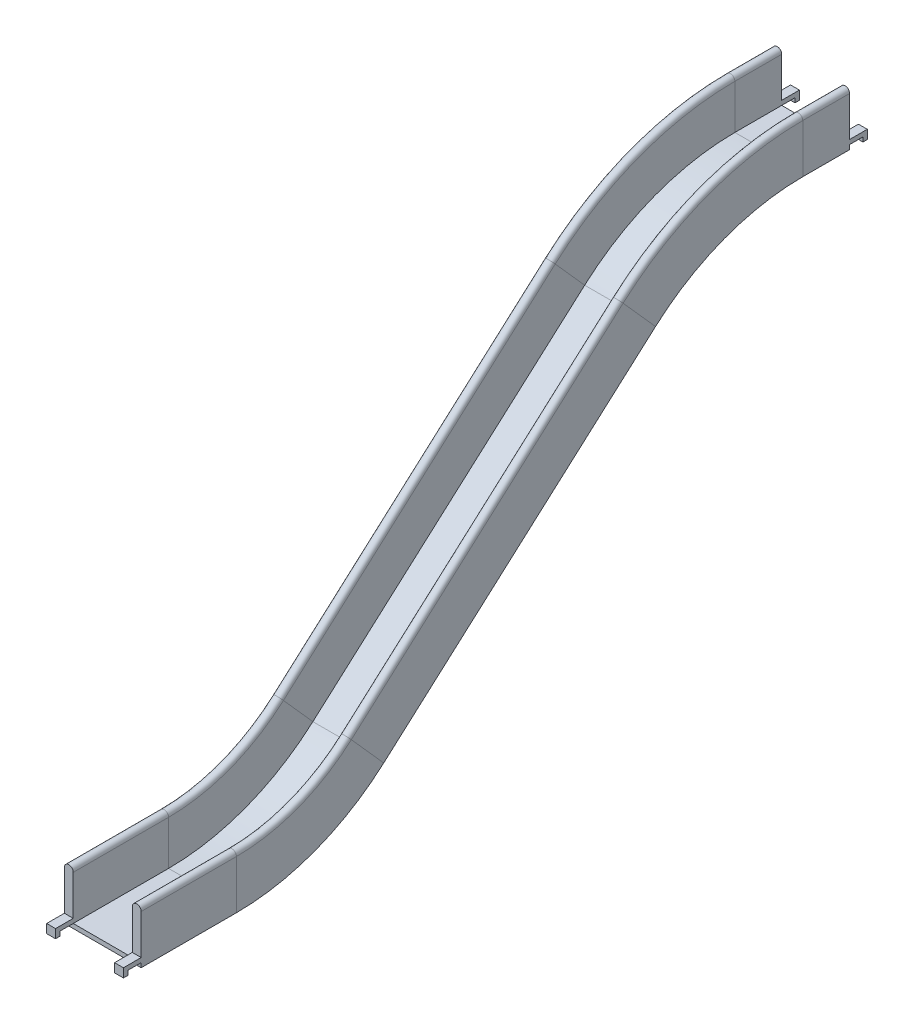
from build123d import *

# Parameters (mm, degrees)
SKETCH3_W           = 1
SKETCH3_H           = 0.5
BOSS_EXTRUDE1_DEPTH = 2
BOSS_EXTRUDE2_START = 1.5
SKETCH3_3_W         = 1
SKETCH3_3_H         = 0.5
BOSS_EXTRUDE2_DEPTH = 0.5
SKETCH5_W           = 1
SKETCH5_H           = 0.5
BOSS_EXTRUDE3_DEPTH = 2
BOSS_EXTRUDE4_START = 1.5
SKETCH5_3_W         = 1
SKETCH5_3_H         = 0.5
BOSS_EXTRUDE4_DEPTH = 0.5


with BuildPart() as part:
    # Sweep1: sweep along a path in Sketch2
    with BuildLine(Plane.YZ) as sweep1_path:
        Line((0, 0), (0, 5.289768345))
        ThreePointArc((0, 5.289768345), (-1.636519098, 14.186271038), (-6.331820813, 21.918030005))
        Line((-6.331820813, 21.918030005), (-33.668179187, 52.60795099))
        ThreePointArc((-33.668179187, 52.60795099), (-38.363480902, 60.339709958), (-40, 69.23621265))
        Line((-40, 69.23621265), (-40, 80))
    # Sketch1 → Sweep1 (sweep)
    with BuildSketch(Plane.XY):
        with BuildLine():
            ThreePointArc((3.333333333, 5.5), (3.833333333, 6), (4.333333333, 5.5))
            Line((4.333333333, 5.5), (4.333333333, 0))
            Line((4.333333333, 0), (-4.333333333, 0))
            Line((-4.333333333, 0), (-4.333333333, 5.5))
            ThreePointArc((-4.333333333, 5.5), (-3.833333333, 6), (-3.333333333, 5.5))
            Line((-3.333333333, 5.5), (-3.333333333, 0.5))
            Line((-3.333333333, 0.5), (3.333333333, 0.5))
            Line((3.333333333, 0.5), (3.333333333, 5.5))
        make_face()
    sweep(path=sweep1_path.line)

    # Sketch3 → Boss-Extrude1 (add)
    with BuildSketch(Plane.XY.offset(80)):
        with Locations((-3.833333333, -39.25)):
            Rectangle(SKETCH3_W, SKETCH3_H)
        with Locations((3.833333333, -39.25)):
            Rectangle(SKETCH3_W, SKETCH3_H)
    extrude(amount=BOSS_EXTRUDE1_DEPTH)

    # Sketch3<3> → Boss-Extrude2 (add)
    with BuildSketch(Plane.XY.offset(80).offset(BOSS_EXTRUDE2_START)):
        with Locations((-3.833333333, -39.75)):
            Rectangle(SKETCH3_3_W, SKETCH3_3_H)
        with Locations((3.833333333, -39.75)):
            Rectangle(SKETCH3_3_W, SKETCH3_3_H)
    extrude(amount=BOSS_EXTRUDE2_DEPTH)

    # Sketch5 → Boss-Extrude3 (add)
    with BuildSketch(Plane(origin=(0, 0, 0), x_dir=(-1, 0, 0), z_dir=(0, 0, -1))):
        with Locations((-3.833333333, 0.75)):
            Rectangle(SKETCH5_W, SKETCH5_H)
        with Locations((3.833333333, 0.75)):
            Rectangle(SKETCH5_W, SKETCH5_H)
    extrude(amount=BOSS_EXTRUDE3_DEPTH)

    # Sketch5<3> → Boss-Extrude4 (add)
    with BuildSketch(Plane(origin=(0, 0, 0), x_dir=(-1, 0, 0), z_dir=(0, 0, -1)).offset(BOSS_EXTRUDE4_START)):
        with Locations((-3.833333333, 0.25)):
            Rectangle(SKETCH5_3_W, SKETCH5_3_H)
        with Locations((3.833333333, 0.25)):
            Rectangle(SKETCH5_3_W, SKETCH5_3_H)
    extrude(amount=BOSS_EXTRUDE4_DEPTH)


solid = part.part
